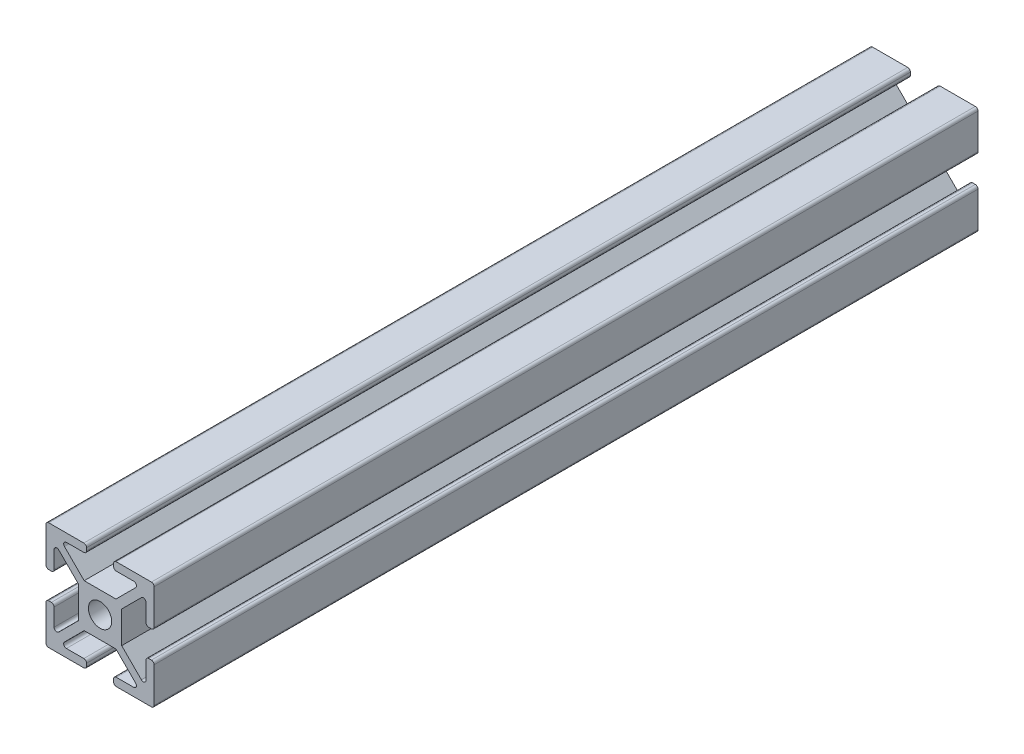
from build123d import *

# Parameters (mm, degrees)
SKETCH1_R           = 2.15
BOSS_EXTRUDE1_DEPTH = 152.4
FILLET1_R           = 0.5


with BuildPart() as part:
    # Sketch1 → Boss-Extrude1 (new body)
    with BuildSketch(Plane.XY):
        Polygon((-10, 2.5), (-8.5, 2.5), (-8.5, 7.439339828), (-4, 2.939339828), (-4, 0), (-4, -2.939339828), (-8.5, -7.439339828), (-8.5, -2.5), (-10, -2.5), (-10, -10), (-2.5, -10), (-2.5, -8.5), (-7.439339828, -8.5), (-2.939339828, -4), (0, -4), (2.939339828, -4), (7.439339828, -8.5), (2.5, -8.5), (2.5, -10), (10, -10), (10, -2.5), (8.5, -2.5), (8.5, -7.439339828), (4, -2.939339828), (4, 0), (4, 2.939339828), (8.5, 7.439339828), (8.5, 2.5), (10, 2.5), (10, 10), (2.5, 10), (2.5, 8.5), (7.439339828, 8.5), (2.939339828, 4), (0, 4), (-2.939339828, 4), (-7.439339828, 8.5), (-2.5, 8.5), (-2.5, 10), (-10, 10), align=None)
        with Locations(Location((0, 0, 0), (0, 0, 180))):
            Circle(SKETCH1_R, mode=Mode.SUBTRACT)
    extrude(amount=BOSS_EXTRUDE1_DEPTH)

    # Fillet1
    fillet1_edges = [part.edges().sort_by_distance(p)[0] for p in [
        (7.439339828, 8.5, 76.2),
        (2.5, 8.5, 76.2),
        (2.5, 10, 76.2),
        (10, 10, 76.2),
        (10, 2.5, 76.2),
        (8.5, 2.5, 76.2),
        (8.5, 7.439339828, 76.2),
        (8.5, -7.439339828, 76.2),
        (8.5, -2.5, 76.2),
        (10, -2.5, 76.2),
        (10, -10, 76.2),
        (2.5, -10, 76.2),
        (2.5, -8.5, 76.2),
        (7.439339828, -8.5, 76.2),
        (-7.439339828, -8.5, 76.2),
        (-2.5, -8.5, 76.2),
        (-2.5, -10, 76.2),
        (-10, -10, 76.2),
        (-10, -2.5, 76.2),
        (-8.5, -2.5, 76.2),
        (-8.5, -7.439339828, 76.2),
        (-8.5, 7.439339828, 76.2),
        (-8.5, 2.5, 76.2),
        (-10, 2.5, 76.2),
        (-10, 10, 76.2),
        (-2.5, 10, 76.2),
        (-2.5, 8.5, 76.2),
        (-7.439339828, 8.5, 76.2),
    ]]
    fillet(fillet1_edges, radius=FILLET1_R)


solid = part.part
